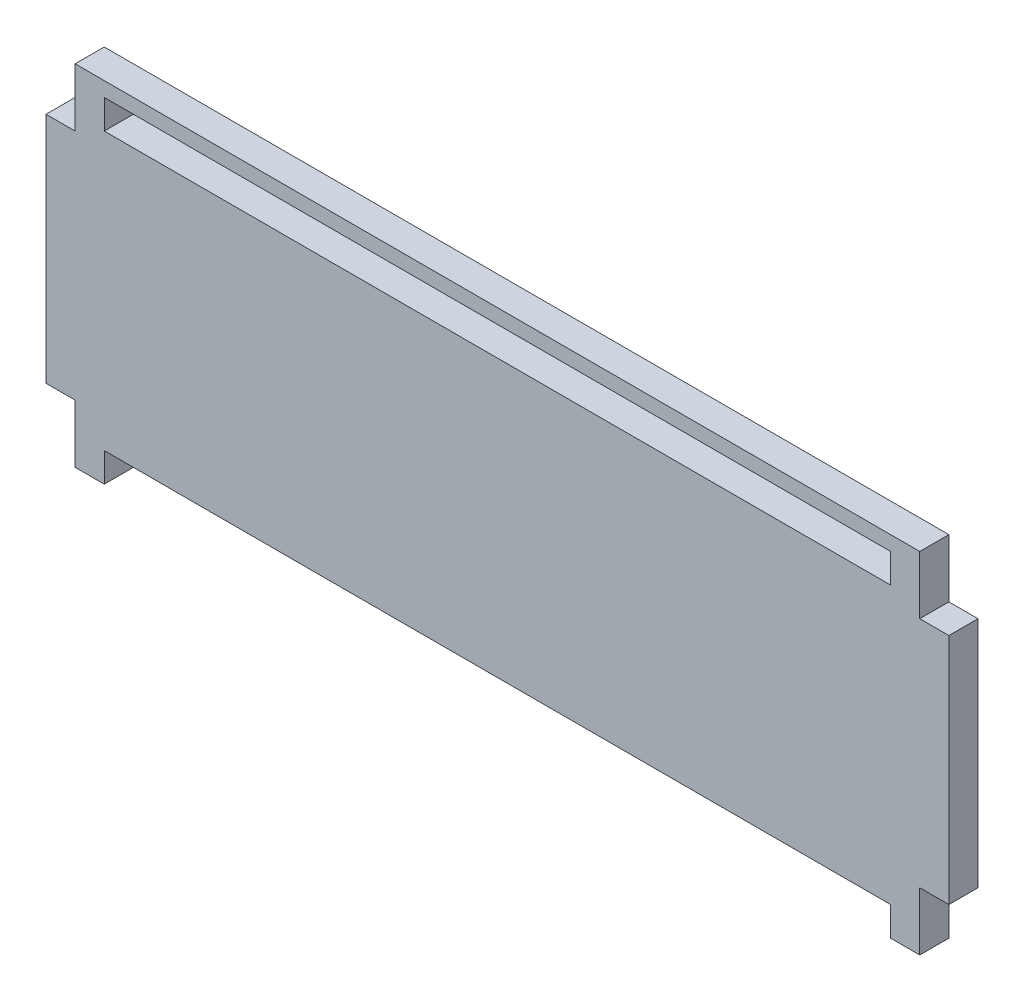
from build123d import *

# Parameters (mm, degrees)
SKETCH1_W           = 196.85
SKETCH1_H           = 76.2
BOSS_EXTRUDE1_DEPTH = 6.35
SKETCH2_W           = 6.35
SKETCH2_H           = 12.7
SKETCH2_W_2         = 171.45
SKETCH2_H_2         = 6.35
CUT_EXTRUDE1_DEPTH  = 121.65


with BuildPart() as part:
    # Sketch1 → Boss-Extrude1 (new body)
    with BuildSketch(Plane.XY):
        with Locations((15.875, 0)):
            Rectangle(SKETCH1_W, SKETCH1_H)
    extrude(amount=BOSS_EXTRUDE1_DEPTH)

    # Sketch2 → Cut-Extrude1 (cut, through all)
    with BuildSketch(Plane.XY.offset(6.35)):
        with Locations((-79.375, 31.75)):
            Rectangle(SKETCH2_W, SKETCH2_H)
        with Locations((-79.375, -31.75)):
            Rectangle(SKETCH2_W, SKETCH2_H)
        with Locations((111.125, 31.75)):
            Rectangle(SKETCH2_W, SKETCH2_H)
        with Locations((15.875, 31.75)):
            Rectangle(SKETCH2_W_2, SKETCH2_H_2)
        with Locations((111.125, -31.75)):
            Rectangle(SKETCH2_W, SKETCH2_H)
        with Locations((15.875, -34.925)):
            Rectangle(SKETCH2_W_2, SKETCH2_H_2)
    extrude(amount=-CUT_EXTRUDE1_DEPTH, mode=Mode.SUBTRACT)


solid = part.part
